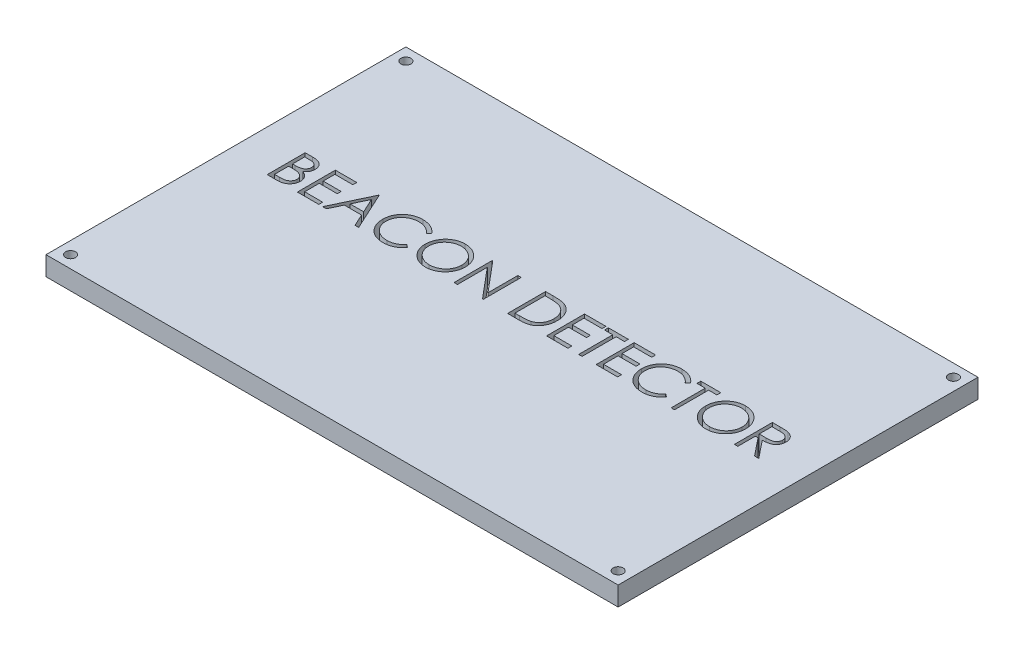
from build123d import *

# Parameters (mm, degrees)
SKETCH1_W           = 159.512
SKETCH1_H           = 100.33
BOSS_EXTRUDE1_DEPTH = 5.334
SKETCH2_R           = 1.397
CUT_EXTRUDE1_DEPTH  = 147.710432419
CUT_EXTRUDE2_DEPTH  = 147.710432419


with BuildPart() as part:
    # Sketch1 → Boss-Extrude1 (new body)
    with BuildSketch(Plane(origin=(0, 0, 0), x_dir=(1, 0, 0), z_dir=(0, 1, 0))):
        with Locations((-54.024132715, 9.8214611)):
            Rectangle(SKETCH1_W, SKETCH1_H)
    extrude(amount=BOSS_EXTRUDE1_DEPTH)

    # Sketch2 → Cut-Extrude1 (cut, through all)
    with BuildSketch(Plane(origin=(0, 5.334, 0), x_dir=(1, 0, 0), z_dir=(0, 1, 0))):
        with Locations(Location((-130.351132715, 56.5574611, 0), (0, 0, 270))):
            Circle(SKETCH2_R)
        with Locations(Location((22.302867285, 56.5574611, 0), (0, 0, 90))):
            Circle(SKETCH2_R)
        with Locations(Location((22.302867285, -36.9145389, 0), (0, 0, 270))):
            Circle(SKETCH2_R)
        with Locations(Location((-130.351132715, -36.9145389, 0), (0, 0, 90))):
            Circle(SKETCH2_R)
    extrude(amount=-CUT_EXTRUDE1_DEPTH, mode=Mode.SUBTRACT)

    # Sketch3 → Cut-Extrude2 (cut, through all)
    # profile 1 of 14: a face of its own
    with BuildSketch(Plane(origin=(0, 5.334, 0), x_dir=(1, 0, 0), z_dir=(0, 1, 0))):
        with BuildLine():
            Line((-122.273064339, 20.404794434), (-120.208127106, 20.404794434))
            add(Edge.make_bspline(
                [(-120.208127106, 20.404794434), (-120.107045755, 20.404262998), (-119.911124941, 20.403232943), (-119.626223295, 20.387257761), (-119.359375701, 20.365475235), (-119.110504771, 20.330912812), (-118.879725504, 20.289209105), (-118.66634241, 20.238705995), (-118.471034032, 20.17814933), (-118.237859805, 20.081852241), (-117.972004474, 19.938755994), (-117.684142667, 19.727305333), (-117.437991753, 19.468671456), (-117.225761698, 19.176926284), (-117.057029742, 18.855991926), (-116.934960676, 18.513517713), (-116.857678529, 18.153921017), (-116.849730644, 17.907047598), (-116.845713912, 17.782281747)],
                knots=[0, 0, 0, 0, 1.001505555, 1.941167018, 2.826882275, 3.653841531, 4.429895133, 5.150066043, 5.825578002, 6.45369114, 7.647487171, 8.808567382, 9.977351308, 11.170798116, 12.373658725, 13.556498008, 14.765093433, 16, 16, 16, 16], degree=3))
            add(Edge.make_bspline(
                [(-116.845713912, 17.782281747), (-116.849019596, 17.665403781), (-116.855515577, 17.435727555), (-116.917632969, 17.09980013), (-117.014880704, 16.780028587), (-117.150060862, 16.477579945), (-117.325750232, 16.19928783), (-117.533964672, 15.942907287), (-117.785173098, 15.719293377), (-117.9733848, 15.594280314), (-118.068987817, 15.530779343)],
                knots=[0, 0, 0, 0, 1.044552857, 2.05264487, 3.044412934, 4.028983338, 5.005914585, 5.980388656, 6.974128949, 8, 8, 8, 8], degree=3))
            add(Edge.make_bspline(
                [(-118.068987817, 15.530779343), (-117.948759857, 15.484620894), (-117.718733987, 15.396308346), (-117.402183426, 15.240172538), (-117.129451395, 15.070349014), (-116.898440977, 14.884893181), (-116.700872354, 14.68499273), (-116.528355126, 14.467716551), (-116.381151923, 14.230230307), (-116.255019988, 13.975010093), (-116.156598749, 13.704661962), (-116.082890657, 13.421721758), (-116.040655752, 13.127204056), (-116.034645503, 12.926769694), (-116.031611348, 12.825584364)],
                knots=[0, 0, 0, 0, 1.27268992, 2.434971085, 3.483601985, 4.442670788, 5.356604649, 6.2567628, 7.179492994, 8.113709626, 9.066344395, 10.018646069, 10.999752585, 12, 12, 12, 12], degree=3))
            add(Edge.make_bspline(
                [(-116.031611348, 12.825584364), (-116.034565144, 12.722270251), (-116.040376821, 12.518996839), (-116.083254355, 12.220380122), (-116.155853321, 11.93500826), (-116.255854168, 11.661035445), (-116.386368786, 11.398991705), (-116.545203345, 11.148580169), (-116.734589264, 10.912316836), (-116.946446034, 10.687576357), (-117.186119664, 10.485501857), (-117.444703019, 10.305537696), (-117.725452605, 10.157534127), (-118.023757444, 10.03320711), (-118.342963828, 9.938237724), (-118.681638379, 9.871796846), (-119.039489006, 9.827029234), (-119.285051825, 9.823348638), (-119.410985012, 9.8214611)],
                knots=[0, 0, 0, 0, 0.978564426, 1.925352924, 2.850884081, 3.763762016, 4.682927383, 5.618979971, 6.567305752, 7.547517671, 8.540179244, 9.531824382, 10.526200242, 11.540722885, 12.589160233, 13.674978461, 14.80764778, 16, 16, 16, 16], degree=3))
            Line((-119.410985012, 9.8214611), (-122.273064339, 9.8214611))
            Line((-122.273064339, 9.8214611), (-122.273064339, 20.404794434))
        make_face()
        with BuildLine():
            Line((-121.323278014, 19.319324348), (-121.323278014, 15.927230331))
            Line((-121.323278014, 15.927230331), (-120.685140327, 15.927230331))
            add(Edge.make_bspline(
                [(-120.685140327, 15.927230331), (-120.591859446, 15.928439622), (-120.411621774, 15.930776219), (-120.150606849, 15.937469473), (-119.908324056, 15.956211175), (-119.685191608, 15.974947492), (-119.481560885, 16.005411126), (-119.297883018, 16.041673021), (-119.131275355, 16.08002371), (-118.939143873, 16.14524573), (-118.721209005, 16.241637748), (-118.488880332, 16.391231157), (-118.284064198, 16.569407178), (-118.111110797, 16.774998895), (-117.969561827, 17.001379981), (-117.871246545, 17.244938405), (-117.804579757, 17.499604043), (-117.798557746, 17.674435426), (-117.795500236, 17.763201218)],
                knots=[0, 0, 0, 0, 1.156816544, 2.235205308, 3.236616184, 4.169592532, 5.011045266, 5.787822928, 6.49130361, 7.128639758, 8.301311294, 9.436451833, 10.541879658, 11.654887649, 12.756523258, 13.837046038, 14.901820046, 16, 16, 16, 16], degree=3))
            add(Edge.make_bspline(
                [(-117.795500236, 17.763201218), (-117.797091305, 17.821941051), (-117.80021236, 17.937165647), (-117.825773537, 18.105136313), (-117.869218345, 18.26311147), (-117.925020613, 18.413256042), (-118.003000696, 18.550875208), (-118.094814025, 18.680727252), (-118.205744565, 18.798390086), (-118.332010724, 18.908364522), (-118.477179655, 19.005865832), (-118.641164752, 19.091260521), (-118.826184633, 19.160024298), (-119.029121123, 19.220246949), (-119.253097983, 19.262544885), (-119.495530561, 19.29778251), (-119.758404592, 19.315721992), (-119.940271926, 19.318096779), (-120.034282288, 19.319324348)],
                knots=[0, 0, 0, 0, 0.91205012, 1.789085906, 2.630437955, 3.453916878, 4.269457761, 5.079663411, 5.91843418, 6.774407191, 7.675494373, 8.627863946, 9.638891023, 10.736472738, 11.911756761, 13.175263542, 14.539845004, 16, 16, 16, 16], degree=3))
            Line((-120.034282288, 19.319324348), (-121.323278014, 19.319324348))
        make_face(mode=Mode.SUBTRACT)
        with BuildLine():
            Line((-121.323278014, 14.841760246), (-121.323278014, 10.906931186))
            Line((-121.323278014, 10.906931186), (-119.970680525, 10.906931186))
            add(Edge.make_bspline(
                [(-119.970680525, 10.906931186), (-119.873861392, 10.908091565), (-119.687255277, 10.910328042), (-119.417830128, 10.917629195), (-119.168114553, 10.934236791), (-118.939248047, 10.960380194), (-118.728759297, 10.988738838), (-118.539173386, 11.026872949), (-118.368953491, 11.070563853), (-118.171576418, 11.138098136), (-117.949315809, 11.243013655), (-117.709797268, 11.401201911), (-117.496841798, 11.589655723), (-117.316002086, 11.807765868), (-117.167796144, 12.044927262), (-117.05998084, 12.296342963), (-116.993484678, 12.557858724), (-116.985434785, 12.736162831), (-116.981397672, 12.825584364)],
                knots=[0, 0, 0, 0, 1.160039823, 2.235823828, 3.228722157, 4.157150951, 4.99529583, 5.772374946, 6.472645482, 7.099169577, 8.269452708, 9.405989375, 10.527446681, 11.663510218, 12.788923519, 13.866172445, 14.929861265, 16, 16, 16, 16], degree=3))
            add(Edge.make_bspline(
                [(-116.981397672, 12.825584364), (-116.982232559, 12.881504703), (-116.983888866, 12.992443382), (-117.008867392, 13.155474549), (-117.045195046, 13.313395642), (-117.092159144, 13.466635477), (-117.160556104, 13.612423543), (-117.240404466, 13.753643187), (-117.334025847, 13.89048109), (-117.479907016, 14.063480046), (-117.692093731, 14.262800538), (-117.993588028, 14.457949652), (-118.336404262, 14.615332307), (-118.585044538, 14.682156914), (-118.71348568, 14.716676779)],
                knots=[0, 0, 0, 0, 0.723448775, 1.435228256, 2.130040452, 2.821711965, 3.505591119, 4.210454504, 4.921174351, 5.648778258, 7.137944449, 8.670945889, 10.280296675, 12, 12, 12, 12], degree=3))
            add(Edge.make_bspline(
                [(-118.71348568, 14.716676779), (-118.764978422, 14.727124294), (-118.876625308, 14.749776664), (-119.058681564, 14.773688052), (-119.266525739, 14.794990972), (-119.500637772, 14.81074852), (-119.761313863, 14.827036402), (-120.049110736, 14.833370742), (-120.362853092, 14.840928028), (-120.580544314, 14.841475744), (-120.693620562, 14.841760246)],
                knots=[0, 0, 0, 0, 0.634451884, 1.375622551, 2.216452059, 3.157844607, 4.20941857, 5.370758133, 6.634282058, 8, 8, 8, 8], degree=3))
            Line((-120.693620562, 14.841760246), (-121.323278014, 14.841760246))
        make_face(mode=Mode.SUBTRACT)
    # profile 2 of 14: a face of its own
    with BuildSketch(Plane(origin=(0, 5.334, 0), x_dir=(1, 0, 0), z_dir=(0, 1, 0))):
        Polygon((-113.860671177, 20.404794434), (-107.890585707, 20.404794434), (-107.890585707, 19.319324348), (-112.910884852, 19.319324348), (-112.910884852, 16.062914092), (-107.890585707, 16.062914092), (-107.890585707, 14.977444006), (-112.910884852, 14.977444006), (-112.910884852, 10.906931186), (-107.890585707, 10.906931186), (-107.890585707, 9.8214611), (-113.860671177, 9.8214611), align=None)
    # profile 3 of 14: a face of its own
    with BuildSketch(Plane(origin=(0, 5.334, 0), x_dir=(1, 0, 0), z_dir=(0, 1, 0))):
        Polygon((-101.649132715, 20.404794434), (-96.76451733, 9.8214611), (-97.796985947, 9.8214611), (-99.361589312, 13.213555117), (-104.159282288, 13.213555117), (-105.768406887, 9.8214611), (-106.805115621, 9.8214611), (-101.784816476, 20.404794434), align=None)
        Polygon((-101.727574889, 18.341977259), (-103.644108009, 14.299025203), (-99.86192318, 14.299025203), align=None, mode=Mode.SUBTRACT)
    # profile 4 of 14: a face of its own
    with BuildSketch(Plane(origin=(0, 5.334, 0), x_dir=(1, 0, 0), z_dir=(0, 1, 0))):
        with BuildLine():
            Line((-85.095713912, 18.462820609), (-85.926776946, 17.826802981))
            add(Edge.make_bspline(
                [(-85.926776946, 17.826802981), (-85.986061418, 17.897457223), (-86.103831078, 18.037813135), (-86.293300572, 18.234903662), (-86.490760301, 18.419553381), (-86.696134787, 18.592641922), (-86.913120696, 18.748116428), (-87.136461682, 18.894079048), (-87.369893867, 19.024912447), (-87.692690779, 19.183550524), (-88.114959272, 19.349092469), (-88.646529381, 19.487895097), (-89.201431988, 19.576254366), (-89.580005682, 19.585824244), (-89.772563538, 19.59069187)],
                knots=[0, 0, 0, 0, 0.757959112, 1.505699292, 2.245454638, 2.979532153, 3.711538275, 4.438200793, 5.171680507, 5.909471876, 7.393775596, 8.890124382, 10.418191784, 12, 12, 12, 12], degree=3))
            add(Edge.make_bspline(
                [(-89.772563538, 19.59069187), (-89.878648752, 19.589470364), (-90.089834611, 19.587038689), (-90.403247852, 19.554958715), (-90.710808745, 19.509870056), (-91.012317226, 19.442967293), (-91.307389505, 19.358383421), (-91.597954626, 19.257311336), (-91.879805725, 19.132262178), (-92.156841827, 18.994049106), (-92.422269441, 18.837937547), (-92.673412085, 18.667656697), (-92.909353798, 18.485112048), (-93.13028122, 18.289619417), (-93.336420207, 18.082059203), (-93.526277075, 17.860219409), (-93.699194863, 17.624809265), (-93.858601106, 17.378933009), (-94.001363419, 17.123306829), (-94.120894244, 16.856984592), (-94.226743066, 16.584526948), (-94.3105003, 16.30285558), (-94.376795863, 16.013952455), (-94.422539035, 15.717042215), (-94.454254174, 15.412745136), (-94.456673757, 15.206493167), (-94.457893399, 15.102527473)],
                knots=[0, 0, 0, 0, 1.054917814, 2.100044995, 3.131103042, 4.146048494, 5.169673617, 6.183595914, 7.203665975, 8.234915748, 9.262203917, 10.264457458, 11.251630812, 12.227803204, 13.197192746, 14.159520551, 15.12972552, 16.100847026, 17.073214652, 18.039054194, 19.002613845, 19.979014051, 20.95965708, 21.949030935, 22.966165397, 24, 24, 24, 24], degree=3))
            add(Edge.make_bspline(
                [(-94.457893399, 15.102527473), (-94.454077898, 14.946101815), (-94.44658667, 14.638980785), (-94.379916707, 14.189126796), (-94.278603693, 13.758171425), (-94.126761353, 13.348808569), (-93.939529938, 12.955990438), (-93.702945232, 12.586363429), (-93.428938083, 12.234341913), (-93.113632101, 11.90824538), (-92.767690705, 11.610358639), (-92.396524401, 11.348041405), (-92.001057626, 11.129374975), (-91.585656863, 10.947414374), (-91.147125518, 10.807542841), (-90.686252187, 10.709075134), (-90.204039249, 10.644842826), (-89.87453654, 10.638693341), (-89.706841716, 10.635563664)],
                knots=[0, 0, 0, 0, 1.029171465, 2.020641659, 2.987623507, 3.938342917, 4.889210282, 5.84687017, 6.821220943, 7.821438502, 8.827599549, 9.822697543, 10.807740252, 11.797342354, 12.80366471, 13.83203677, 14.896651826, 16, 16, 16, 16], degree=3))
            add(Edge.make_bspline(
                [(-89.706841716, 10.635563664), (-89.522078823, 10.640670213), (-89.158421251, 10.650721121), (-88.625117933, 10.735869327), (-88.114590737, 10.873930174), (-87.626812202, 11.06714532), (-87.163157438, 11.318318929), (-86.72290087, 11.622810129), (-86.305670883, 11.983515326), (-86.05478153, 12.258933357), (-85.926776946, 12.399452553)],
                knots=[0, 0, 0, 0, 1.028121516, 2.023589091, 2.998037872, 3.967518031, 4.937445131, 5.927275754, 6.942489185, 8, 8, 8, 8], degree=3))
            Line((-85.926776946, 12.399452553), (-85.095713912, 11.769795101))
            add(Edge.make_bspline(
                [(-85.095713912, 11.769795101), (-85.162594863, 11.683500259), (-85.29603641, 11.511323921), (-85.512111842, 11.26859756), (-85.739736051, 11.040287739), (-85.980599745, 10.82823517), (-86.231932115, 10.628196667), (-86.498246012, 10.445855415), (-86.776040467, 10.278666312), (-87.064374249, 10.125580136), (-87.362941007, 9.989758937), (-87.671382988, 9.873482067), (-87.988370681, 9.773318711), (-88.313918575, 9.690914045), (-88.648701935, 9.626594339), (-88.991512655, 9.583596751), (-89.343090611, 9.554139057), (-89.580282527, 9.551454169), (-89.70048154, 9.550093579)],
                knots=[0, 0, 0, 0, 0.986787822, 1.968848986, 2.935600012, 3.899624008, 4.868462664, 5.837806735, 6.815139263, 7.798259679, 8.787526145, 9.778297419, 10.776456485, 11.791383307, 12.812564526, 13.85620153, 14.913611965, 16, 16, 16, 16], degree=3))
            add(Edge.make_bspline(
                [(-89.70048154, 9.550093579), (-89.814308819, 9.550885795), (-90.039388167, 9.552452303), (-90.371701059, 9.577828618), (-90.695217173, 9.612450442), (-91.009011875, 9.664581314), (-91.314797561, 9.726098724), (-91.609802186, 9.808561809), (-91.896928655, 9.90093667), (-92.1750234, 10.009506511), (-92.444322968, 10.13201973), (-92.703958779, 10.270484682), (-92.953811419, 10.423736987), (-93.196337335, 10.588398566), (-93.427953838, 10.769758502), (-93.650668069, 10.965298088), (-93.86572889, 11.174358263), (-93.998784628, 11.325109843), (-94.065682528, 11.400904877)],
                knots=[0, 0, 0, 0, 1.114604814, 2.203992996, 3.262667896, 4.300477797, 5.318619304, 6.316056647, 7.298880507, 8.271930387, 9.238335007, 10.195173496, 11.151986948, 12.108099108, 13.064862484, 14.031167946, 15.010108607, 16, 16, 16, 16], degree=3))
            add(Edge.make_bspline(
                [(-94.065682528, 11.400904877), (-94.172833164, 11.532565139), (-94.385840821, 11.794296144), (-94.658363721, 12.21849423), (-94.891643233, 12.661386195), (-95.080256136, 13.125298837), (-95.227705353, 13.609191175), (-95.329853253, 14.113307135), (-95.396230723, 14.637175912), (-95.403821358, 14.993491916), (-95.407679724, 15.174609471)],
                knots=[0, 0, 0, 0, 0.994628077, 1.977248131, 2.950237994, 3.925870899, 4.908910175, 5.911660606, 6.938484602, 8, 8, 8, 8], degree=3))
            add(Edge.make_bspline(
                [(-95.407679724, 15.174609471), (-95.402977115, 15.364974771), (-95.393725025, 15.739506614), (-95.315118691, 16.289156425), (-95.188666617, 16.815757084), (-95.009061739, 17.31832555), (-94.781352701, 17.799505207), (-94.50005794, 18.255620278), (-94.168445391, 18.689587744), (-93.789115841, 19.094822825), (-93.373138422, 19.465358487), (-92.92767439, 19.791343912), (-92.453595645, 20.062632592), (-91.956124999, 20.289406702), (-91.431537342, 20.463712579), (-90.880951917, 20.585732929), (-90.305403293, 20.661682304), (-89.912724054, 20.671283528), (-89.713201892, 20.676161955)],
                knots=[0, 0, 0, 0, 1.032925535, 2.032216505, 3.007276963, 3.968222605, 4.92396291, 5.891752235, 6.871517503, 7.883894988, 8.900124299, 9.891468569, 10.874487609, 11.85992873, 12.854644235, 13.869047385, 14.917252991, 16, 16, 16, 16], degree=3))
            add(Edge.make_bspline(
                [(-89.713201892, 20.676161955), (-89.591600989, 20.674704061), (-89.350904247, 20.671818306), (-88.994842656, 20.643678305), (-88.648186095, 20.596768115), (-88.310695745, 20.532917142), (-87.980729739, 20.453671194), (-87.660809963, 20.350437435), (-87.349059172, 20.232398399), (-87.047443521, 20.096452562), (-86.757410143, 19.943850749), (-86.47904937, 19.776284458), (-86.214572298, 19.593961427), (-85.962117923, 19.398432302), (-85.72590938, 19.185560468), (-85.499240147, 18.96120107), (-85.289807839, 18.71889165), (-85.160530321, 18.548333873), (-85.095713912, 18.462820609)],
                knots=[0, 0, 0, 0, 1.096760587, 2.17092713, 3.219439832, 4.250915756, 5.268269357, 6.278326846, 7.281116186, 8.274029601, 9.260640565, 10.235837813, 11.203064059, 12.156899882, 13.114053108, 14.069676657, 15.032185724, 16, 16, 16, 16], degree=3))
        make_face()
    # profile 5 of 14: a face of its own
    with BuildSketch(Plane(origin=(0, 5.334, 0), x_dir=(1, 0, 0), z_dir=(0, 1, 0))):
        with BuildLine():
            add(Edge.make_bspline(
                [(-77.972316476, 20.676161955), (-77.776349108, 20.671198434), (-77.391453029, 20.661449669), (-76.825774172, 20.586824761), (-76.285736622, 20.457722034), (-75.766941202, 20.285779206), (-75.275593392, 20.056409993), (-74.807994836, 19.779171569), (-74.365258099, 19.451159419), (-73.953350588, 19.074909138), (-73.576411714, 18.665535361), (-73.244319153, 18.228661681), (-72.966000789, 17.766929588), (-72.737443766, 17.2817266), (-72.558136065, 16.77415003), (-72.434404671, 16.241493879), (-72.355367884, 15.687209364), (-72.346127795, 15.309151939), (-72.341440407, 15.117367884)],
                knots=[0, 0, 0, 0, 1.065120563, 2.091984664, 3.0946048, 4.079830382, 5.057816894, 6.036188127, 7.030412546, 8.04752943, 9.064399622, 10.05169764, 11.02544977, 11.989514704, 12.962713494, 13.945757189, 14.957906945, 16, 16, 16, 16], degree=3))
            add(Edge.make_bspline(
                [(-72.341440407, 15.117367884), (-72.346127108, 14.926996559), (-72.355365138, 14.551752621), (-72.434494537, 14.000985539), (-72.558594704, 13.471544624), (-72.735778651, 12.964313721), (-72.963246169, 12.478757755), (-73.243417758, 12.016154347), (-73.573439991, 11.57635184), (-73.94901785, 11.164168304), (-74.35844481, 10.786199762), (-74.797593474, 10.456849828), (-75.256587561, 10.173445928), (-75.741333583, 9.947314342), (-76.245402742, 9.76657544), (-76.773306433, 9.643347249), (-77.322571013, 9.563860237), (-77.697133334, 9.55473282), (-77.887514125, 9.550093579)],
                knots=[0, 0, 0, 0, 1.043624062, 2.057103931, 3.04512605, 4.022047818, 4.998200453, 5.980619268, 6.982898556, 8.009068085, 9.034988726, 10.034168286, 11.015286542, 11.987931943, 12.962482838, 13.94673481, 14.956375938, 16, 16, 16, 16], degree=3))
            add(Edge.make_bspline(
                [(-77.887514125, 9.550093579), (-78.079297185, 9.55477863), (-78.457352648, 9.564014112), (-79.012333683, 9.643181693), (-79.545364004, 9.766980397), (-80.054919304, 9.943901788), (-80.541283734, 10.17255389), (-81.005408508, 10.45136237), (-81.445430691, 10.782188725), (-81.857702163, 11.157644796), (-82.234919976, 11.566377822), (-82.563787612, 12.004329022), (-82.842658788, 12.462906236), (-83.070543151, 12.943382083), (-83.250957111, 13.443433826), (-83.374040728, 13.96639708), (-83.453675631, 14.509290347), (-83.462852428, 14.878929588), (-83.467508783, 15.066486474)],
                knots=[0, 0, 0, 0, 1.053102029, 2.075944431, 3.073151272, 4.055350789, 5.033113405, 6.020478099, 7.024410459, 8.052272461, 9.079885166, 10.07527673, 11.055994387, 12.023226415, 12.992069828, 13.970394897, 14.97016774, 16, 16, 16, 16], degree=3))
            add(Edge.make_bspline(
                [(-83.467508783, 15.066486474), (-83.465892148, 15.192375736), (-83.46267927, 15.442566109), (-83.423999629, 15.814091305), (-83.36787258, 16.179641627), (-83.287433463, 16.538177589), (-83.182230089, 16.888821519), (-83.058096578, 17.233991683), (-82.906483236, 17.570190085), (-82.735091753, 17.899009389), (-82.543800095, 18.215323771), (-82.332509138, 18.514316796), (-82.108640286, 18.798497429), (-81.863217644, 19.060501465), (-81.604329821, 19.307950854), (-81.327777106, 19.537042879), (-81.035246986, 19.749843326), (-80.725480743, 19.941614358), (-80.406111197, 20.115057455), (-80.07688856, 20.263894957), (-79.742284165, 20.391639), (-79.400730825, 20.495176733), (-79.053135538, 20.576916461), (-78.698739665, 20.632576793), (-78.337825543, 20.671355087), (-78.094677031, 20.674552772), (-77.972316476, 20.676161955)],
                knots=[0, 0, 0, 0, 1.037015668, 2.060948919, 3.074880161, 4.083647147, 5.086022904, 6.090072063, 7.104153813, 8.122640571, 9.144368836, 10.147691507, 11.138137339, 12.123020368, 13.103399296, 14.087645067, 15.080126199, 16.082011238, 17.087798457, 18.072939717, 19.057185487, 20.037253025, 21.01195951, 21.997135196, 22.992090687, 24, 24, 24, 24], degree=3))
        make_face()
        with BuildLine():
            add(Edge.make_bspline(
                [(-77.925675183, 19.59069187), (-78.026109908, 19.589467559), (-78.226019196, 19.587030641), (-78.523212913, 19.554930739), (-78.816498046, 19.509180837), (-79.105935165, 19.443922429), (-79.39031323, 19.355010174), (-79.672282988, 19.252681713), (-79.949273175, 19.128036987), (-80.220369364, 18.98721), (-80.483183996, 18.831335882), (-80.731174784, 18.659064111), (-80.964983731, 18.474434673), (-81.184038371, 18.277016688), (-81.387695487, 18.065804797), (-81.579963512, 17.844001002), (-81.753135819, 17.605265522), (-81.911842206, 17.356072149), (-82.053864009, 17.096745463), (-82.180154486, 16.830015642), (-82.283459941, 16.553706922), (-82.36771046, 16.270816969), (-82.437559888, 15.981793817), (-82.481810087, 15.684444941), (-82.514262698, 15.380264483), (-82.516560326, 15.174700306), (-82.517722459, 15.070726592)],
                knots=[0, 0, 0, 0, 1.008559885, 2.007477868, 2.99961109, 3.989939068, 4.984837346, 5.991145699, 7.001802488, 8.033829008, 9.059044045, 10.069351652, 11.065060232, 12.050310815, 13.029377138, 14.011219647, 14.996725999, 15.989392538, 16.977580475, 17.965360261, 18.951710183, 19.937753436, 20.929683414, 21.935841486, 22.955955122, 24, 24, 24, 24], degree=3))
            add(Edge.make_bspline(
                [(-82.517722459, 15.070726592), (-82.513867519, 14.917836067), (-82.50628366, 14.617053106), (-82.43988815, 14.176278005), (-82.337616942, 13.75267771), (-82.186857762, 13.348570032), (-81.99832138, 12.960481367), (-81.765406736, 12.591854479), (-81.489456643, 12.24258974), (-81.175997884, 11.915125475), (-80.833331605, 11.61623459), (-80.46946835, 11.353878569), (-80.088306251, 11.131899956), (-79.688851329, 10.951060809), (-79.273236151, 10.807763268), (-78.838782604, 10.709554074), (-78.388384786, 10.644918769), (-78.081375424, 10.638711626), (-77.925675183, 10.635563664)],
                knots=[0, 0, 0, 0, 1.032063989, 2.030389145, 3.003944642, 3.970395727, 4.937377036, 5.913328081, 6.909231446, 7.93887556, 8.970685674, 9.976071282, 10.964166581, 11.944589148, 12.933237628, 13.927779006, 14.949070134, 16, 16, 16, 16], degree=3))
            add(Edge.make_bspline(
                [(-77.925675183, 10.635563664), (-77.821022642, 10.637001499), (-77.613465223, 10.639853157), (-77.30474781, 10.668575346), (-77.001592122, 10.714633618), (-76.704423371, 10.780947744), (-76.413578822, 10.863942868), (-76.127844537, 10.962542426), (-75.850263992, 11.085554637), (-75.577335435, 11.221468681), (-75.316089657, 11.376409158), (-75.066699357, 11.542834039), (-74.83545056, 11.727191535), (-74.616559797, 11.921676349), (-74.412066547, 12.130209889), (-74.223353666, 12.352521036), (-74.0510566, 12.590013023), (-73.892410478, 12.838828417), (-73.750886326, 13.098864705), (-73.627578098, 13.366561588), (-73.522966034, 13.641259895), (-73.438515555, 13.923355837), (-73.372338087, 14.212313642), (-73.326739282, 14.508520211), (-73.294842812, 14.811382985), (-73.292438651, 15.016227502), (-73.291226732, 15.119487943)],
                knots=[0, 0, 0, 0, 1.047197238, 2.076906641, 3.100256066, 4.114471768, 5.12198147, 6.126382909, 7.136867548, 8.15857795, 9.17633901, 10.174870724, 11.156907918, 12.133735059, 13.104061851, 14.077631395, 15.04955518, 16.038496417, 17.029181396, 18.010275684, 18.986308667, 19.968651475, 20.955262928, 21.950658345, 22.966943676, 24, 24, 24, 24], degree=3))
            add(Edge.make_bspline(
                [(-73.291226732, 15.119487943), (-73.292439621, 15.222041968), (-73.294845611, 15.425476767), (-73.326724046, 15.726227337), (-73.372386262, 16.020302524), (-73.438192546, 16.306547833), (-73.523010868, 16.585036231), (-73.627596367, 16.855506158), (-73.750923344, 17.118965224), (-73.892462498, 17.374762265), (-74.051562727, 17.620219211), (-74.225414367, 17.854874125), (-74.41701911, 18.074320271), (-74.620902566, 18.28397518), (-74.842157386, 18.47936737), (-75.079781323, 18.660561658), (-75.330889587, 18.831930845), (-75.596764799, 18.986524806), (-75.87115723, 19.129291652), (-76.152716103, 19.251607781), (-76.438251714, 19.355542523), (-76.727037958, 19.444191441), (-77.021505536, 19.508925246), (-77.319664733, 19.554971968), (-77.621103038, 19.587019469), (-77.823828965, 19.589463851), (-77.925675183, 19.59069187)],
                knots=[0, 0, 0, 0, 1.02996197, 2.043119294, 3.035359645, 4.018872909, 4.991431989, 5.957985074, 6.929999688, 7.912076566, 8.892894881, 9.867085534, 10.843653904, 11.817741046, 12.803660682, 13.806313499, 14.818574707, 15.856120519, 16.894564902, 17.924820532, 18.937903209, 19.946497019, 20.957711757, 21.963978472, 22.977135795, 24, 24, 24, 24], degree=3))
        make_face(mode=Mode.SUBTRACT)
    # profile 6 of 14: a face of its own
    with BuildSketch(Plane(origin=(0, 5.334, 0), x_dir=(1, 0, 0), z_dir=(0, 1, 0))):
        Polygon((-70.170500236, 9.8214611), (-70.170500236, 20.404794434), (-69.971214713, 20.404794434), (-62.97926092, 12.075083563), (-62.97926092, 20.404794434), (-62.029474595, 20.404794434), (-62.029474595, 9.8214611), (-62.245720589, 9.8214611), (-69.220713912, 18.132091442), (-69.220713912, 9.8214611), align=None)
    # profile 7 of 14: a face of its own
    with BuildSketch(Plane(origin=(0, 5.334, 0), x_dir=(1, 0, 0), z_dir=(0, 1, 0))):
        with BuildLine():
            Line((-55.245286561, 9.8214611), (-55.245286561, 20.404794434))
            Line((-55.245286561, 20.404794434), (-53.10826733, 20.404794434))
            add(Edge.make_bspline(
                [(-53.10826733, 20.404794434), (-52.922396819, 20.403456186), (-52.563295957, 20.400870699), (-52.044372604, 20.384477445), (-51.564240751, 20.355477703), (-51.124479486, 20.313236517), (-50.723881536, 20.261369011), (-50.363568602, 20.196355883), (-50.041677598, 20.119586892), (-49.84371048, 20.054135173), (-49.750094254, 20.023183857)],
                knots=[0, 0, 0, 0, 1.314313732, 2.53924729, 3.670748893, 4.714932338, 5.66265055, 6.526160246, 7.303039223, 8, 8, 8, 8], degree=3))
            add(Edge.make_bspline(
                [(-49.750094254, 20.023183857), (-49.627645875, 19.976524342), (-49.385525841, 19.884263396), (-49.040790018, 19.710224104), (-48.716258564, 19.513032105), (-48.410191149, 19.292427473), (-48.129579127, 19.042163848), (-47.86346001, 18.772872184), (-47.62272025, 18.474759822), (-47.40225945, 18.154009263), (-47.203487337, 17.81439901), (-47.030709408, 17.456576181), (-46.887217571, 17.082357957), (-46.768099957, 16.692785009), (-46.674221383, 16.287000724), (-46.610171256, 15.864532605), (-46.567925644, 15.427050295), (-46.56368006, 15.130189416), (-46.561525877, 14.979564065)],
                knots=[0, 0, 0, 0, 0.984719456, 1.947108742, 2.898477687, 3.838006223, 4.779231079, 5.722358779, 6.681677486, 7.655904652, 8.64651281, 9.637519902, 10.640069247, 11.656948941, 12.698408672, 13.768548281, 14.867775369, 16, 16, 16, 16], degree=3))
            add(Edge.make_bspline(
                [(-46.561525877, 14.979564065), (-46.563427755, 14.84875032), (-46.567175604, 14.590968173), (-46.600828536, 14.211054036), (-46.649742646, 13.842410618), (-46.72547153, 13.486793382), (-46.81740294, 13.141086628), (-46.935223112, 12.808974841), (-47.07019235, 12.487411418), (-47.227581269, 12.180744288), (-47.400365933, 11.890206472), (-47.585791204, 11.616323327), (-47.783659307, 11.363003014), (-47.995857054, 11.129478401), (-48.219642292, 10.916101533), (-48.456480148, 10.721089963), (-48.706981754, 10.548259428), (-48.97002513, 10.39081841), (-49.253283902, 10.253475907), (-49.562123307, 10.137270877), (-49.89786044, 10.040972778), (-50.259671215, 9.960627451), (-50.648180778, 9.896893702), (-51.063770032, 9.854178182), (-51.505800456, 9.825291933), (-51.809328234, 9.822762839), (-51.965555658, 9.8214611)],
                knots=[0, 0, 0, 0, 1.105936401, 2.179363191, 3.223086493, 4.248585256, 5.251745608, 6.245858792, 7.225916811, 8.198733463, 9.158002045, 10.082870192, 10.993790845, 11.873723703, 12.748670949, 13.606408763, 14.465103618, 15.319838547, 16.196477973, 17.123216899, 18.106603292, 19.147568657, 20.255746949, 21.433717677, 22.679120308, 24, 24, 24, 24], degree=3))
            Line((-51.965555658, 9.8214611), (-55.245286561, 9.8214611))
        make_face()
        with BuildLine():
            Line((-54.295500236, 10.906931186), (-53.080706567, 10.906931186))
            add(Edge.make_bspline(
                [(-53.080706567, 10.906931186), (-52.906146969, 10.907681382), (-52.570404936, 10.909124284), (-52.087629563, 10.921785589), (-51.646518055, 10.942474304), (-51.247007777, 10.971427516), (-50.889324298, 11.009734995), (-50.572720102, 11.052446011), (-50.298233012, 11.10565735), (-50.132136857, 11.153890013), (-50.055382715, 11.176178648)],
                knots=[0, 0, 0, 0, 1.375205317, 2.645023457, 3.804390687, 4.853969522, 5.800190428, 6.637939096, 7.370582563, 8, 8, 8, 8], degree=3))
            add(Edge.make_bspline(
                [(-50.055382715, 11.176178648), (-49.958776954, 11.210201217), (-49.767872857, 11.277433727), (-49.493065766, 11.400072369), (-49.236776728, 11.545342437), (-48.994539271, 11.706820742), (-48.769789622, 11.8902027), (-48.559864318, 12.09150069), (-48.365186014, 12.311739177), (-48.187766083, 12.550644808), (-48.028990973, 12.806730619), (-47.891494636, 13.077478997), (-47.770991196, 13.359923399), (-47.676410689, 13.658401093), (-47.602280233, 13.970243722), (-47.549772724, 14.295473224), (-47.517071057, 14.634028862), (-47.513256679, 14.864298381), (-47.511312202, 14.981684124)],
                knots=[0, 0, 0, 0, 0.998632004, 1.973411704, 2.929992603, 3.868527914, 4.809262121, 5.754881198, 6.702106254, 7.672490631, 8.653608572, 9.636854334, 10.631411391, 11.644891563, 12.686317036, 13.754757253, 14.855430412, 16, 16, 16, 16], degree=3))
            add(Edge.make_bspline(
                [(-47.511312202, 14.981684124), (-47.512864285, 15.105459171), (-47.515913367, 15.348616348), (-47.554238067, 15.705397736), (-47.610243723, 16.048541608), (-47.691232488, 16.378070913), (-47.794437765, 16.694628549), (-47.923235848, 16.996463735), (-48.070394435, 17.286764172), (-48.245483096, 17.558829516), (-48.437239771, 17.81613487), (-48.650049073, 18.051855686), (-48.880529999, 18.266528927), (-49.126168711, 18.463497801), (-49.393888035, 18.634837964), (-49.677381338, 18.788104833), (-49.980807534, 18.918176695), (-50.191907828, 18.987358018), (-50.299189473, 19.022516122)],
                knots=[0, 0, 0, 0, 1.122418816, 2.205001699, 3.251619955, 4.274784885, 5.280384055, 6.268708349, 7.249350384, 8.229342522, 9.199999885, 10.157847722, 11.105861043, 12.055065948, 13.010012805, 13.98527497, 14.976112212, 16, 16, 16, 16], degree=3))
            add(Edge.make_bspline(
                [(-50.299189473, 19.022516122), (-50.387941748, 19.047058654), (-50.576653438, 19.09924281), (-50.884596579, 19.156167151), (-51.23117096, 19.206375993), (-51.617915294, 19.248884826), (-52.04438873, 19.279386965), (-52.510919263, 19.302281178), (-53.017708543, 19.317722662), (-53.369022396, 19.318777086), (-53.551359611, 19.319324348)],
                knots=[0, 0, 0, 0, 0.674548936, 1.434276114, 2.292660221, 3.240891867, 4.284742987, 5.42552168, 6.663806718, 8, 8, 8, 8], degree=3))
            Line((-53.551359611, 19.319324348), (-54.295500236, 19.319324348))
            Line((-54.295500236, 19.319324348), (-54.295500236, 10.906931186))
        make_face(mode=Mode.SUBTRACT)
    # profile 8 of 14: a face of its own
    with BuildSketch(Plane(origin=(0, 5.334, 0), x_dir=(1, 0, 0), z_dir=(0, 1, 0))):
        Polygon((-44.390585707, 20.404794434), (-38.420500236, 20.404794434), (-38.420500236, 19.319324348), (-43.440799382, 19.319324348), (-43.440799382, 16.062914092), (-38.420500236, 16.062914092), (-38.420500236, 14.977444006), (-43.440799382, 14.977444006), (-43.440799382, 10.906931186), (-38.420500236, 10.906931186), (-38.420500236, 9.8214611), (-44.390585707, 9.8214611), align=None)
    # profile 9 of 14: a face of its own
    with BuildSketch(Plane(origin=(0, 5.334, 0), x_dir=(1, 0, 0), z_dir=(0, 1, 0))):
        Polygon((-37.742081433, 19.319324348), (-37.742081433, 20.404794434), (-32.179047245, 20.404794434), (-32.179047245, 19.319324348), (-34.485671177, 19.319324348), (-34.485671177, 9.8214611), (-35.435457501, 9.8214611), (-35.435457501, 19.319324348), align=None)
    # profile 10 of 14: a face of its own
    with BuildSketch(Plane(origin=(0, 5.334, 0), x_dir=(1, 0, 0), z_dir=(0, 1, 0))):
        Polygon((-30.550842117, 20.404794434), (-24.580756647, 20.404794434), (-24.580756647, 19.319324348), (-29.601055792, 19.319324348), (-29.601055792, 16.062914092), (-24.580756647, 16.062914092), (-24.580756647, 14.977444006), (-29.601055792, 14.977444006), (-29.601055792, 10.906931186), (-24.580756647, 10.906931186), (-24.580756647, 9.8214611), (-30.550842117, 9.8214611), align=None)
    # profile 11 of 14: a face of its own
    with BuildSketch(Plane(origin=(0, 5.334, 0), x_dir=(1, 0, 0), z_dir=(0, 1, 0))):
        with BuildLine():
            Line((-12.911953228, 18.462820609), (-13.743016262, 17.826802981))
            add(Edge.make_bspline(
                [(-13.743016262, 17.826802981), (-13.802300734, 17.897457223), (-13.920070395, 18.037813135), (-14.109539888, 18.234903662), (-14.306999618, 18.419553381), (-14.512374103, 18.592641922), (-14.729360012, 18.748116428), (-14.952700999, 18.894079048), (-15.186133183, 19.024912447), (-15.508930095, 19.183550524), (-15.931198588, 19.349092469), (-16.462768697, 19.487895097), (-17.017671304, 19.576254366), (-17.396244999, 19.585824244), (-17.588802854, 19.59069187)],
                knots=[0, 0, 0, 0, 0.757959112, 1.505699292, 2.245454638, 2.979532153, 3.711538275, 4.438200793, 5.171680507, 5.909471876, 7.393775596, 8.890124382, 10.418191784, 12, 12, 12, 12], degree=3))
            add(Edge.make_bspline(
                [(-17.588802854, 19.59069187), (-17.694888069, 19.589470364), (-17.906073927, 19.587038689), (-18.219487168, 19.554958715), (-18.527048061, 19.509870056), (-18.828556542, 19.442967293), (-19.123628822, 19.358383421), (-19.414193942, 19.257311336), (-19.696045042, 19.132262178), (-19.973081143, 18.994049106), (-20.238508757, 18.837937547), (-20.489651402, 18.667656697), (-20.725593114, 18.485112048), (-20.946520536, 18.289619417), (-21.152659523, 18.082059203), (-21.342516392, 17.860219409), (-21.51543418, 17.624809265), (-21.674840422, 17.378933009), (-21.817602735, 17.123306829), (-21.937133561, 16.856984592), (-22.042982383, 16.584526948), (-22.126739616, 16.30285558), (-22.193035179, 16.013952455), (-22.238778351, 15.717042215), (-22.27049349, 15.412745136), (-22.272913073, 15.206493167), (-22.274132715, 15.102527473)],
                knots=[0, 0, 0, 0, 1.054917814, 2.100044995, 3.131103042, 4.146048494, 5.169673617, 6.183595914, 7.203665975, 8.234915748, 9.262203917, 10.264457458, 11.251630812, 12.227803204, 13.197192746, 14.159520551, 15.12972552, 16.100847026, 17.073214652, 18.039054194, 19.002613845, 19.979014051, 20.95965708, 21.949030935, 22.966165397, 24, 24, 24, 24], degree=3))
            add(Edge.make_bspline(
                [(-22.274132715, 15.102527473), (-22.270317215, 14.946101815), (-22.262825986, 14.638980785), (-22.196156023, 14.189126796), (-22.094843009, 13.758171425), (-21.943000669, 13.348808569), (-21.755769255, 12.955990438), (-21.519184548, 12.586363429), (-21.2451774, 12.234341913), (-20.929871417, 11.90824538), (-20.583930021, 11.610358639), (-20.212763717, 11.348041405), (-19.817296942, 11.129374975), (-19.401896179, 10.947414374), (-18.963364835, 10.807542841), (-18.502491504, 10.709075134), (-18.020278566, 10.644842826), (-17.690775856, 10.638693341), (-17.523081032, 10.635563664)],
                knots=[0, 0, 0, 0, 1.029171465, 2.020641659, 2.987623507, 3.938342917, 4.889210282, 5.84687017, 6.821220943, 7.821438502, 8.827599549, 9.822697543, 10.807740252, 11.797342354, 12.80366471, 13.83203677, 14.896651826, 16, 16, 16, 16], degree=3))
            add(Edge.make_bspline(
                [(-17.523081032, 10.635563664), (-17.338318139, 10.640670213), (-16.974660567, 10.650721121), (-16.44135725, 10.735869327), (-15.930830053, 10.873930174), (-15.443051518, 11.06714532), (-14.979396754, 11.318318929), (-14.539140186, 11.622810129), (-14.121910199, 11.983515326), (-13.871020846, 12.258933357), (-13.743016262, 12.399452553)],
                knots=[0, 0, 0, 0, 1.028121516, 2.023589091, 2.998037872, 3.967518031, 4.937445131, 5.927275754, 6.942489185, 8, 8, 8, 8], degree=3))
            Line((-13.743016262, 12.399452553), (-12.911953228, 11.769795101))
            add(Edge.make_bspline(
                [(-12.911953228, 11.769795101), (-12.978834179, 11.683500259), (-13.112275726, 11.511323921), (-13.328351158, 11.26859756), (-13.555975367, 11.040287739), (-13.796839061, 10.82823517), (-14.048171431, 10.628196667), (-14.314485328, 10.445855415), (-14.592279784, 10.278666312), (-14.880613565, 10.125580136), (-15.179180323, 9.989758937), (-15.487622305, 9.873482067), (-15.804609997, 9.773318711), (-16.130157892, 9.690914045), (-16.464941252, 9.626594339), (-16.807751971, 9.583596751), (-17.159329927, 9.554139057), (-17.396521843, 9.551454169), (-17.516720856, 9.550093579)],
                knots=[0, 0, 0, 0, 0.986787822, 1.968848986, 2.935600012, 3.899624008, 4.868462664, 5.837806735, 6.815139263, 7.798259679, 8.787526145, 9.778297419, 10.776456485, 11.791383307, 12.812564526, 13.85620153, 14.913611965, 16, 16, 16, 16], degree=3))
            add(Edge.make_bspline(
                [(-17.516720856, 9.550093579), (-17.630548135, 9.550885795), (-17.855627484, 9.552452303), (-18.187940375, 9.577828618), (-18.511456489, 9.612450442), (-18.825251191, 9.664581314), (-19.131036877, 9.726098724), (-19.426041502, 9.808561809), (-19.713167971, 9.90093667), (-19.991262716, 10.009506511), (-20.260562284, 10.13201973), (-20.520198095, 10.270484682), (-20.770050736, 10.423736987), (-21.012576651, 10.588398566), (-21.244193154, 10.769758502), (-21.466907385, 10.965298088), (-21.681968206, 11.174358263), (-21.815023944, 11.325109843), (-21.881921844, 11.400904877)],
                knots=[0, 0, 0, 0, 1.114604814, 2.203992996, 3.262667896, 4.300477797, 5.318619304, 6.316056647, 7.298880507, 8.271930387, 9.238335007, 10.195173496, 11.151986948, 12.108099108, 13.064862484, 14.031167946, 15.010108607, 16, 16, 16, 16], degree=3))
            add(Edge.make_bspline(
                [(-21.881921844, 11.400904877), (-21.989072481, 11.532565139), (-22.202080137, 11.794296144), (-22.474603037, 12.21849423), (-22.707882549, 12.661386195), (-22.896495453, 13.125298837), (-23.043944669, 13.609191175), (-23.146092569, 14.113307135), (-23.21247004, 14.637175912), (-23.220060675, 14.993491916), (-23.22391904, 15.174609471)],
                knots=[0, 0, 0, 0, 0.994628077, 1.977248131, 2.950237994, 3.925870899, 4.908910175, 5.911660606, 6.938484602, 8, 8, 8, 8], degree=3))
            add(Edge.make_bspline(
                [(-23.22391904, 15.174609471), (-23.219216431, 15.364974771), (-23.209964341, 15.739506614), (-23.131358007, 16.289156425), (-23.004905933, 16.815757084), (-22.825301055, 17.31832555), (-22.597592017, 17.799505207), (-22.316297256, 18.255620278), (-21.984684707, 18.689587744), (-21.605355157, 19.094822825), (-21.189377738, 19.465358487), (-20.743913706, 19.791343912), (-20.269834962, 20.062632592), (-19.772364315, 20.289406702), (-19.247776659, 20.463712579), (-18.697191233, 20.585732929), (-18.12164261, 20.661682304), (-17.72896337, 20.671283528), (-17.529441209, 20.676161955)],
                knots=[0, 0, 0, 0, 1.032925535, 2.032216505, 3.007276963, 3.968222605, 4.92396291, 5.891752235, 6.871517503, 7.883894988, 8.900124299, 9.891468569, 10.874487609, 11.85992873, 12.854644235, 13.869047385, 14.917252991, 16, 16, 16, 16], degree=3))
            add(Edge.make_bspline(
                [(-17.529441209, 20.676161955), (-17.407840305, 20.674704061), (-17.167143564, 20.671818306), (-16.811081972, 20.643678305), (-16.464425412, 20.596768115), (-16.126935061, 20.532917142), (-15.796969055, 20.453671194), (-15.477049279, 20.350437435), (-15.165298488, 20.232398399), (-14.863682837, 20.096452562), (-14.573649459, 19.943850749), (-14.295288687, 19.776284458), (-14.030811614, 19.593961427), (-13.778357239, 19.398432302), (-13.542148696, 19.185560468), (-13.315479463, 18.96120107), (-13.106047155, 18.71889165), (-12.976769637, 18.548333873), (-12.911953228, 18.462820609)],
                knots=[0, 0, 0, 0, 1.096760587, 2.17092713, 3.219439832, 4.250915756, 5.268269357, 6.278326846, 7.281116186, 8.274029601, 9.260640565, 10.235837813, 11.203064059, 12.156899882, 13.114053108, 14.069676657, 15.032185724, 16, 16, 16, 16], degree=3))
        make_face()
    # profile 12 of 14: a face of its own
    with BuildSketch(Plane(origin=(0, 5.334, 0), x_dir=(1, 0, 0), z_dir=(0, 1, 0))):
        Polygon((-11.962166903, 19.319324348), (-11.962166903, 20.404794434), (-6.399132715, 20.404794434), (-6.399132715, 19.319324348), (-8.705756647, 19.319324348), (-8.705756647, 9.8214611), (-9.655542971, 9.8214611), (-9.655542971, 19.319324348), align=None)
    # profile 13 of 14: a face of its own
    with BuildSketch(Plane(origin=(0, 5.334, 0), x_dir=(1, 0, 0), z_dir=(0, 1, 0))):
        with BuildLine():
            add(Edge.make_bspline(
                [(0.181529678, 20.676161955), (0.377497046, 20.671198434), (0.762393125, 20.661449669), (1.328071982, 20.586824761), (1.868109532, 20.457722034), (2.386904952, 20.285779206), (2.878252762, 20.056409993), (3.345851318, 19.779171569), (3.788588055, 19.451159419), (4.200495566, 19.074909138), (4.57743444, 18.665535361), (4.909527, 18.228661681), (5.187845365, 17.766929588), (5.416402388, 17.2817266), (5.595710089, 16.77415003), (5.719441483, 16.241493879), (5.79847827, 15.687209364), (5.807718359, 15.309151939), (5.812405746, 15.117367884)],
                knots=[0, 0, 0, 0, 1.065120563, 2.091984664, 3.0946048, 4.079830382, 5.057816894, 6.036188127, 7.030412546, 8.04752943, 9.064399622, 10.05169764, 11.02544977, 11.989514704, 12.962713494, 13.945757189, 14.957906945, 16, 16, 16, 16], degree=3))
            add(Edge.make_bspline(
                [(5.812405746, 15.117367884), (5.807719046, 14.926996559), (5.798481016, 14.551752621), (5.719351617, 14.000985539), (5.59525145, 13.471544624), (5.418067503, 12.964313721), (5.190599984, 12.478757755), (4.910428395, 12.016154347), (4.580406163, 11.57635184), (4.204828304, 11.164168304), (3.795401344, 10.786199762), (3.35625268, 10.456849828), (2.897258593, 10.173445928), (2.412512571, 9.947314342), (1.908443412, 9.76657544), (1.380539721, 9.643347249), (0.831275141, 9.563860237), (0.45671282, 9.55473282), (0.266332029, 9.550093579)],
                knots=[0, 0, 0, 0, 1.043624062, 2.057103931, 3.04512605, 4.022047818, 4.998200453, 5.980619268, 6.982898556, 8.009068085, 9.034988726, 10.034168286, 11.015286542, 11.987931943, 12.962482838, 13.94673481, 14.956375938, 16, 16, 16, 16], degree=3))
            add(Edge.make_bspline(
                [(0.266332029, 9.550093579), (0.074548969, 9.55477863), (-0.303506494, 9.564014112), (-0.858487529, 9.643181693), (-1.39151785, 9.766980397), (-1.90107315, 9.943901788), (-2.38743758, 10.17255389), (-2.851562354, 10.45136237), (-3.291584537, 10.782188725), (-3.703856009, 11.157644796), (-4.081073822, 11.566377822), (-4.409941458, 12.004329022), (-4.688812634, 12.462906236), (-4.916696997, 12.943382083), (-5.097110957, 13.443433826), (-5.220194574, 13.96639708), (-5.299829477, 14.509290347), (-5.309006274, 14.878929588), (-5.31366263, 15.066486474)],
                knots=[0, 0, 0, 0, 1.053102029, 2.075944431, 3.073151272, 4.055350789, 5.033113405, 6.020478099, 7.024410459, 8.052272461, 9.079885166, 10.07527673, 11.055994387, 12.023226415, 12.992069828, 13.970394897, 14.97016774, 16, 16, 16, 16], degree=3))
            add(Edge.make_bspline(
                [(-5.31366263, 15.066486474), (-5.312045994, 15.192375736), (-5.308833116, 15.442566109), (-5.270153475, 15.814091305), (-5.214026426, 16.179641627), (-5.133587309, 16.538177589), (-5.028383935, 16.888821519), (-4.904250424, 17.233991683), (-4.752637082, 17.570190085), (-4.581245599, 17.899009389), (-4.389953941, 18.215323771), (-4.178662985, 18.514316796), (-3.954794132, 18.798497429), (-3.70937149, 19.060501465), (-3.450483667, 19.307950854), (-3.173930952, 19.537042879), (-2.881400833, 19.749843326), (-2.571634589, 19.941614358), (-2.252265044, 20.115057455), (-1.923042406, 20.263894957), (-1.588438011, 20.391639), (-1.246884671, 20.495176733), (-0.899289384, 20.576916461), (-0.544893512, 20.632576793), (-0.183979389, 20.671355087), (0.059169123, 20.674552772), (0.181529678, 20.676161955)],
                knots=[0, 0, 0, 0, 1.037015668, 2.060948919, 3.074880161, 4.083647147, 5.086022904, 6.090072063, 7.104153813, 8.122640571, 9.144368836, 10.147691507, 11.138137339, 12.123020368, 13.103399296, 14.087645067, 15.080126199, 16.082011238, 17.087798457, 18.072939717, 19.057185487, 20.037253025, 21.01195951, 21.997135196, 22.992090687, 24, 24, 24, 24], degree=3))
        make_face()
        with BuildLine():
            add(Edge.make_bspline(
                [(0.228170971, 19.59069187), (0.127736246, 19.589467559), (-0.072173042, 19.587030641), (-0.369366759, 19.554930739), (-0.662651892, 19.509180837), (-0.952089011, 19.443922429), (-1.236467077, 19.355010174), (-1.518436834, 19.252681713), (-1.795427021, 19.128036987), (-2.06652321, 18.98721), (-2.329337842, 18.831335882), (-2.57732863, 18.659064111), (-2.811137577, 18.474434673), (-3.030192217, 18.277016688), (-3.233849333, 18.065804797), (-3.426117359, 17.844001002), (-3.599289665, 17.605265522), (-3.757996052, 17.356072149), (-3.900017855, 17.096745463), (-4.026308332, 16.830015642), (-4.129613787, 16.553706922), (-4.213864306, 16.270816969), (-4.283713734, 15.981793817), (-4.327963933, 15.684444941), (-4.360416544, 15.380264483), (-4.362714172, 15.174700306), (-4.363876305, 15.070726592)],
                knots=[0, 0, 0, 0, 1.008559885, 2.007477868, 2.99961109, 3.989939068, 4.984837346, 5.991145699, 7.001802488, 8.033829008, 9.059044045, 10.069351652, 11.065060232, 12.050310815, 13.029377138, 14.011219647, 14.996725999, 15.989392538, 16.977580475, 17.965360261, 18.951710183, 19.937753436, 20.929683414, 21.935841486, 22.955955122, 24, 24, 24, 24], degree=3))
            add(Edge.make_bspline(
                [(-4.363876305, 15.070726592), (-4.360021365, 14.917836067), (-4.352437506, 14.617053106), (-4.286041996, 14.176278005), (-4.183770788, 13.75267771), (-4.033011609, 13.348570032), (-3.844475226, 12.960481367), (-3.611560582, 12.591854479), (-3.33561049, 12.24258974), (-3.022151731, 11.915125475), (-2.679485451, 11.61623459), (-2.315622196, 11.353878569), (-1.934460098, 11.131899956), (-1.535005175, 10.951060809), (-1.119389997, 10.807763268), (-0.68493645, 10.709554074), (-0.234538632, 10.644918769), (0.07247073, 10.638711626), (0.228170971, 10.635563664)],
                knots=[0, 0, 0, 0, 1.032063989, 2.030389145, 3.003944642, 3.970395727, 4.937377036, 5.913328081, 6.909231446, 7.93887556, 8.970685674, 9.976071282, 10.964166581, 11.944589148, 12.933237628, 13.927779006, 14.949070134, 16, 16, 16, 16], degree=3))
            add(Edge.make_bspline(
                [(0.228170971, 10.635563664), (0.332823511, 10.637001499), (0.540380931, 10.639853157), (0.849098344, 10.668575346), (1.152254032, 10.714633618), (1.449422783, 10.780947744), (1.740267331, 10.863942868), (2.026001617, 10.962542426), (2.303582162, 11.085554637), (2.576510719, 11.221468681), (2.837756497, 11.376409158), (3.087146797, 11.542834039), (3.318395593, 11.727191535), (3.537286357, 11.921676349), (3.741779607, 12.130209889), (3.930492488, 12.352521036), (4.102789554, 12.590013023), (4.261435676, 12.838828417), (4.402959828, 13.098864705), (4.526268056, 13.366561588), (4.63088012, 13.641259895), (4.715330599, 13.923355837), (4.781508067, 14.212313642), (4.827106872, 14.508520211), (4.859003341, 14.811382985), (4.861407503, 15.016227502), (4.862619422, 15.119487943)],
                knots=[0, 0, 0, 0, 1.047197238, 2.076906641, 3.100256066, 4.114471768, 5.12198147, 6.126382909, 7.136867548, 8.15857795, 9.17633901, 10.174870724, 11.156907918, 12.133735059, 13.104061851, 14.077631395, 15.04955518, 16.038496417, 17.029181396, 18.010275684, 18.986308667, 19.968651475, 20.955262928, 21.950658345, 22.966943676, 24, 24, 24, 24], degree=3))
            add(Edge.make_bspline(
                [(4.862619422, 15.119487943), (4.861406532, 15.222041968), (4.859000543, 15.425476767), (4.827122108, 15.726227337), (4.781459892, 16.020302524), (4.715653608, 16.306547833), (4.630835286, 16.585036231), (4.526249787, 16.855506158), (4.40292281, 17.118965224), (4.261383655, 17.374762265), (4.102283427, 17.620219211), (3.928431787, 17.854874125), (3.736827044, 18.074320271), (3.532943587, 18.28397518), (3.311688767, 18.47936737), (3.074064831, 18.660561658), (2.822956567, 18.831930845), (2.557081355, 18.986524806), (2.282688923, 19.129291652), (2.001130051, 19.251607781), (1.71559444, 19.355542523), (1.426808195, 19.444191441), (1.132340618, 19.508925246), (0.834181421, 19.554971968), (0.532743116, 19.587019469), (0.330017189, 19.589463851), (0.228170971, 19.59069187)],
                knots=[0, 0, 0, 0, 1.02996197, 2.043119294, 3.035359645, 4.018872909, 4.991431989, 5.957985074, 6.929999688, 7.912076566, 8.892894881, 9.867085534, 10.843653904, 11.817741046, 12.803660682, 13.806313499, 14.818574707, 15.856120519, 16.894564902, 17.924820532, 18.937903209, 19.946497019, 20.957711757, 21.963978472, 22.977135795, 24, 24, 24, 24], degree=3))
        make_face(mode=Mode.SUBTRACT)
    # profile 14 of 14: a face of its own
    with BuildSketch(Plane(origin=(0, 5.334, 0), x_dir=(1, 0, 0), z_dir=(0, 1, 0))):
        with BuildLine():
            Line((7.983345917, 20.404794434), (10.101284619, 20.404794434))
            add(Edge.make_bspline(
                [(10.101284619, 20.404794434), (10.242620889, 20.404323971), (10.514002183, 20.403420631), (10.902783262, 20.398383682), (11.256046151, 20.383946939), (11.573606141, 20.371523365), (11.855457407, 20.348869162), (12.102464215, 20.327216729), (12.313488919, 20.298872564), (12.441232327, 20.272549023), (12.499071078, 20.260630438)],
                knots=[0, 0, 0, 0, 1.410062039, 2.707475311, 3.878576406, 4.937260626, 5.877586885, 6.699081471, 7.410979367, 8, 8, 8, 8], degree=3))
            add(Edge.make_bspline(
                [(12.499071078, 20.260630438), (12.576500632, 20.241499505), (12.729707957, 20.203645753), (12.950295061, 20.12363696), (13.160493136, 20.031049047), (13.359429034, 19.922301607), (13.546106307, 19.796587392), (13.72244977, 19.656076641), (13.889259624, 19.501538186), (14.039789791, 19.329075689), (14.181724543, 19.148141481), (14.301433009, 18.952489645), (14.404624983, 18.747894073), (14.486783451, 18.532274024), (14.552938276, 18.307720571), (14.599584285, 18.072199686), (14.627558115, 17.826784357), (14.630406106, 17.659392585), (14.631850191, 17.574515988)],
                knots=[0, 0, 0, 0, 1.027469482, 2.033020251, 3.019912614, 3.986113645, 4.951240523, 5.91722682, 6.890402269, 7.87763091, 8.8651537, 9.85103654, 10.82876324, 11.815024772, 12.821070561, 13.842952187, 14.906261191, 16, 16, 16, 16], degree=3))
            add(Edge.make_bspline(
                [(14.631850191, 17.574515988), (14.62740822, 17.433500315), (14.618740786, 17.158342212), (14.537929163, 16.759015261), (14.405557305, 16.386514238), (14.223151169, 16.041308166), (13.990863707, 15.730125977), (13.711691125, 15.456802457), (13.38547768, 15.228081769), (13.081798558, 15.069474479), (12.813543716, 14.967895922), (12.59270489, 14.896424075), (12.351807124, 14.84120337), (12.093158517, 14.791733448), (11.815682702, 14.754384277), (11.520044726, 14.727029098), (11.206033743, 14.709932332), (10.990317986, 14.707386269), (10.879346184, 14.706076485)],
                knots=[0, 0, 0, 0, 1.260483769, 2.459530307, 3.627416485, 4.787058657, 5.939039949, 7.08810263, 8.267026773, 9.491475466, 10.141966685, 10.831826277, 11.566392101, 12.351337768, 13.187381173, 14.07005841, 15.007169909, 16, 16, 16, 16], degree=3))
            Line((10.879346184, 14.706076485), (14.767533952, 9.8214611))
            Line((14.767533952, 9.8214611), (13.593021398, 9.8214611))
            Line((13.593021398, 9.8214611), (9.704833631, 14.706076485))
            Line((9.704833631, 14.706076485), (8.933132242, 14.706076485))
            Line((8.933132242, 14.706076485), (8.933132242, 9.8214611))
            Line((8.933132242, 9.8214611), (7.983345917, 9.8214611))
            Line((7.983345917, 9.8214611), (7.983345917, 20.404794434))
        make_face()
        with BuildLine():
            Line((8.933132242, 19.319324348), (8.933132242, 15.79154657))
            Line((8.933132242, 15.79154657), (10.870865949, 15.776706159))
            add(Edge.make_bspline(
                [(10.870865949, 15.776706159), (10.961338448, 15.776666134), (11.136699918, 15.776588554), (11.390399548, 15.788664973), (11.626619885, 15.802403101), (11.844457398, 15.823416599), (12.0440094, 15.850498054), (12.225176149, 15.884373744), (12.388253377, 15.923840695), (12.578446577, 15.984926564), (12.790828469, 16.081706667), (13.021640265, 16.222511865), (13.218194953, 16.399613726), (13.384256108, 16.6021287), (13.517695103, 16.82479069), (13.611772029, 17.064930664), (13.671469414, 17.31648621), (13.678510492, 17.489381917), (13.682063866, 17.576636047)],
                knots=[0, 0, 0, 0, 1.146690395, 2.22261258, 3.21895312, 4.145990853, 4.996080663, 5.770904154, 6.481378293, 7.121626537, 8.300444488, 9.431385265, 10.535395872, 11.636531494, 12.74115979, 13.810798291, 14.895190096, 16, 16, 16, 16], degree=3))
            add(Edge.make_bspline(
                [(13.682063866, 17.576636047), (13.678428881, 17.661745925), (13.671225667, 17.830402646), (13.612416295, 18.077314566), (13.512965071, 18.310350343), (13.378943065, 18.528562), (13.215659906, 18.726638868), (13.024198901, 18.896114783), (12.809795097, 19.035964355), (12.609403616, 19.125331172), (12.43029064, 19.180122157), (12.274777144, 19.218679248), (12.099059105, 19.249656571), (11.902283313, 19.274476183), (11.685289811, 19.295808991), (11.446981413, 19.310177464), (11.188939244, 19.318686053), (11.010090191, 19.319106632), (10.917507242, 19.319324348)],
                knots=[0, 0, 0, 0, 1.101028733, 2.181837193, 3.264309656, 4.369019818, 5.486613113, 6.575447106, 7.666700264, 8.788928104, 9.402425223, 10.0903467, 10.862060571, 11.710948788, 12.657782767, 13.684531032, 14.801375019, 16, 16, 16, 16], degree=3))
            Line((10.917507242, 19.319324348), (8.933132242, 19.319324348))
        make_face(mode=Mode.SUBTRACT)
    extrude(amount=-CUT_EXTRUDE2_DEPTH, mode=Mode.SUBTRACT)


with BuildPart() as cut_extrude2_piece_1:
    # of the separate pieces the step leaves, piece 1, a body of its own (cut_extrude2_pieces)
    add(part.part.solids().sort_by_distance((-133.780132715, 0, -59.9864611))[0])


with BuildPart() as cut_extrude2_piece_2:
    # of the separate pieces the step leaves, piece 2, a body of its own (cut_extrude2_pieces)
    add(part.part.solids().sort_by_distance((0.228170971, 0, -10.635563664))[0])


with BuildPart() as cut_extrude2_piece_3:
    # of the separate pieces the step leaves, piece 3, a body of its own (cut_extrude2_pieces)
    add(part.part.solids().sort_by_distance((-77.925675183, 0, -10.635563664))[0])


with BuildPart() as cut_extrude2_piece_4:
    # of the separate pieces the step leaves, piece 4, a body of its own (cut_extrude2_pieces)
    add(part.part.solids().sort_by_distance((-50.055382715, 0, -11.176178648))[0])


with BuildPart() as cut_extrude2_piece_5:
    # of the separate pieces the step leaves, piece 5, a body of its own (cut_extrude2_pieces)
    add(part.part.solids().sort_by_distance((10.870865949, 0, -15.776706159))[0])


with BuildPart() as cut_extrude2_piece_6:
    # of the separate pieces the step leaves, piece 6, a body of its own (cut_extrude2_pieces)
    add(part.part.solids().sort_by_distance((-119.970680525, 0, -10.906931186))[0])


with BuildPart() as cut_extrude2_piece_7:
    # of the separate pieces the step leaves, piece 7, a body of its own (cut_extrude2_pieces)
    add(part.part.solids().sort_by_distance((-120.685140327, 0, -15.927230331))[0])


with BuildPart() as cut_extrude2_piece_8:
    # of the separate pieces the step leaves, piece 8, a body of its own (cut_extrude2_pieces)
    add(part.part.solids().sort_by_distance((-99.86192318, 0, -14.299025203))[0])


solid = Compound([cut_extrude2_piece_1.part, cut_extrude2_piece_2.part, cut_extrude2_piece_3.part, cut_extrude2_piece_4.part, cut_extrude2_piece_5.part, cut_extrude2_piece_6.part, cut_extrude2_piece_7.part, cut_extrude2_piece_8.part])
